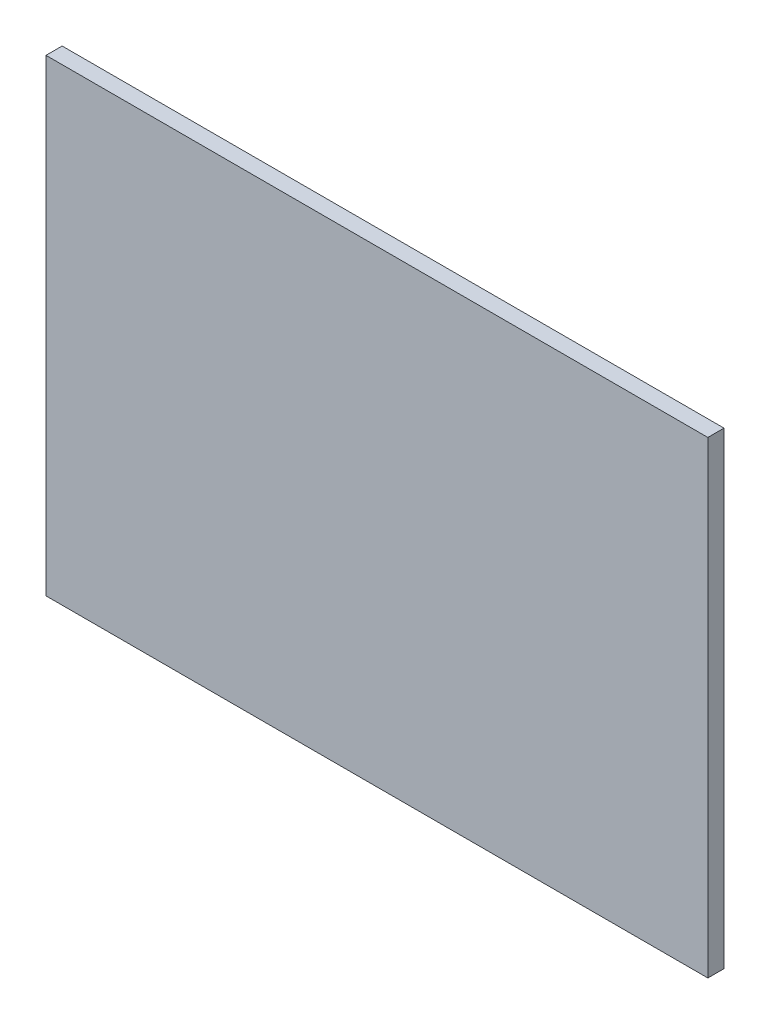
from build123d import *

# Parameters (mm, degrees)
ESBO_O1_W                = 82
ESBO_O1_H                = 58
RESSALTO_EXTRUS_O1_DEPTH = 2


with BuildPart() as part:
    # Esboço1 → Ressalto-extrusão1 (new body)
    with BuildSketch(Plane.XY):
        with Locations((33.891575503, 16.462478336)):
            Rectangle(ESBO_O1_W, ESBO_O1_H)
    extrude(amount=RESSALTO_EXTRUS_O1_DEPTH)


solid = part.part
